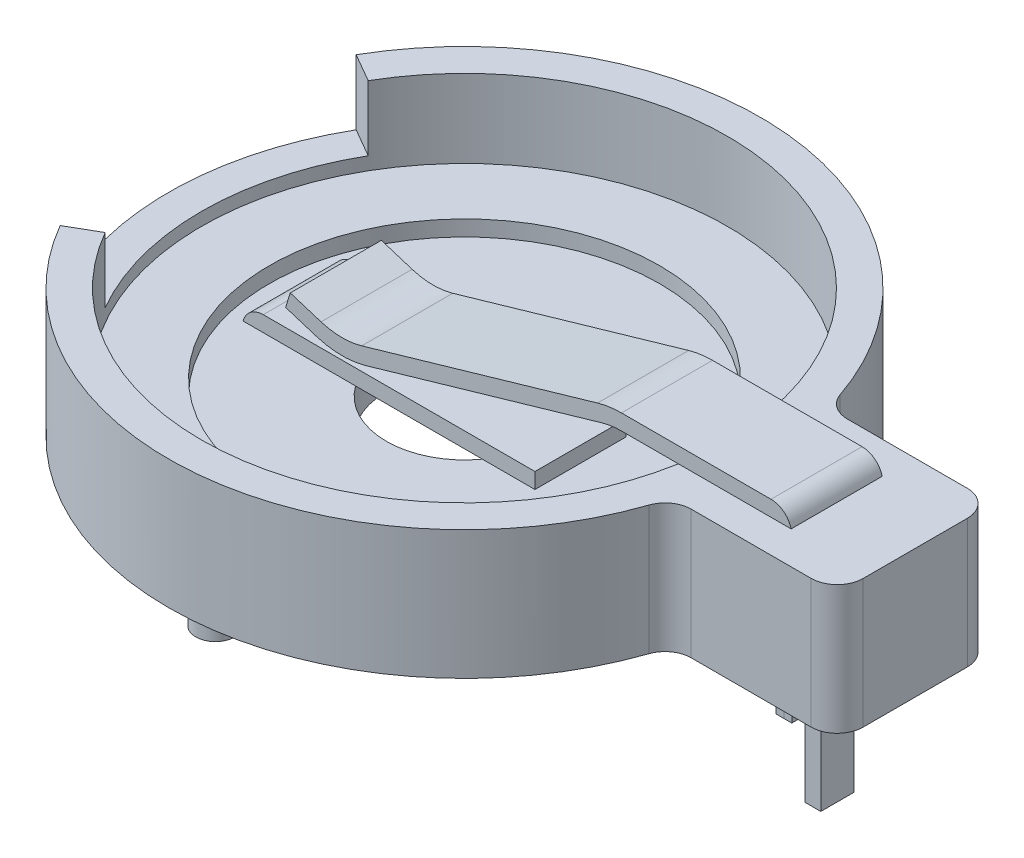
from build123d import *

# Parameters (mm, degrees)
EXTRUDE_1_DEPTH     = 4.95
SKETCH_2_R          = 10.11
CUT_EXTRUDE_1_DEPTH = 3
CUT_EXTRUDE_2_DEPTH = 2.5
SKETCH_4_R          = 7.5
CUT_EXTRUDE_3_DEPTH = 0.6
CUT_EXTRUDE_4_REACH = 23.036
SKETCH_5_R          = 3
SKETCH_8_W          = 3.5
SKETCH_8_H          = 0.6
SKETCH_9_R          = 0.75
EXTRUDE_2_DEPTH     = 1.5
SKETCH_10_W         = 0.6
SKETCH_10_H         = 1.115
CUT_EXTRUDE_5_DEPTH = 3.5
SKETCH_16_W         = 0.6
SKETCH_16_H         = 1.27
EXTRUDE_3_DEPTH     = 3.5


with BuildPart() as part:
    # Эскиз1 → Вытянуть1 (new body)
    with BuildSketch(Plane(origin=(0, 0, 0), x_dir=(1, 0, 0), z_dir=(0, 1, 0))):
        with BuildLine():
            Line((11.710705572, 3), (16.325, 3))
            ThreePointArc((16.325, 3), (17.032106781, 2.707106781), (17.325, 2))
            Line((17.325, 2), (17.325, -2))
            ThreePointArc((17.325, -2), (17.032106781, -2.707106781), (16.325, -3))
            Line((16.325, -3), (11.710705572, -3))
            ThreePointArc((11.710705572, -3), (11.128997881, -3.186602089), (10.76438593, -3.676767677))
            ThreePointArc((10.76438593, -3.676767677), (-11.375, 0), (10.76438593, 3.676767677))
            ThreePointArc((10.76438593, 3.676767677), (11.128997881, 3.186602089), (11.710705572, 3))
        make_face()
    extrude(amount=EXTRUDE_1_DEPTH)

    # Эскиз2 → Вырез-Вытянуть1 (cut)
    with BuildSketch(Plane(origin=(0, 4.95, 0), x_dir=(-1, 0, 0), z_dir=(0, 1, 0))):
        Circle(SKETCH_2_R)
    extrude(amount=-CUT_EXTRUDE_1_DEPTH, mode=Mode.SUBTRACT)

    # Эскиз3 → Вырез-Вытянуть2 (cut)
    with BuildSketch(Plane(origin=(0, 4.95, 0), x_dir=(-1, 0, 0), z_dir=(0, 1, 0))):
        with BuildLine():
            Line((8.755516832, -5.055), (9.851038968, -5.6875))
            ThreePointArc((9.851038968, -5.6875), (11.375, 0), (9.851038968, 5.6875))
            Line((9.851038968, 5.6875), (8.755516832, 5.055))
            ThreePointArc((8.755516832, 5.055), (10.11, 0), (8.755516832, -5.055))
        make_face()
    extrude(amount=-CUT_EXTRUDE_2_DEPTH, mode=Mode.SUBTRACT)

    # Эскиз4 → Вырез-Вытянуть3 (cut)
    with BuildSketch(Plane(origin=(0, 1.95, 0), x_dir=(-1, 0, 0), z_dir=(0, 1, 0))):
        Circle(SKETCH_4_R)
    extrude(amount=-CUT_EXTRUDE_3_DEPTH, mode=Mode.SUBTRACT)

    # Эскиз5 → Вырез-Вытянуть4 (cut, up to next)
    with BuildSketch(Plane(origin=(0, 1.35, 0), x_dir=(-1, 0, 0), z_dir=(0, 1, 0)), mode=Mode.PRIVATE) as cut_extrude_4_sk1:
        Circle(SKETCH_5_R)
    cut_extrude_4_tool1 = extrude(cut_extrude_4_sk1.sketch, amount=-CUT_EXTRUDE_4_REACH, mode=Mode.PRIVATE) & part.part
    add(cut_extrude_4_tool1.solids().sort_by_distance((0, 1.35, 0))[0], mode=Mode.SUBTRACT)

    # По траектории2: sweep along a path in Эскиз7
    with BuildLine(Plane.XY) as sweep_2_path:
        Line((-6.482147214, -5), (-6.482147214, 1.15))
        ThreePointArc((-6.482147214, 1.15), (-6.335700604, 1.503553391), (-5.982147214, 1.65))
        Line((-5.982147214, 1.65), (4.458438225, 1.65))
    # Эскиз8 → По траектории2 (sweep)
    with BuildSketch(Plane(origin=(4.458438225, 0, 0), x_dir=(0, 0, -1), z_dir=(1, 0, 0))):
        with Locations((0, 1.65)):
            Rectangle(SKETCH_8_W, SKETCH_8_H)
    sweep(path=sweep_2_path.line)

    # Эскиз9 → Вытянуть2 (add)
    with BuildSketch(Plane.XZ):
        with Locations((0, 9.575)):
            Circle(SKETCH_9_R)
        with Locations((8.292193241, -4.7875)):
            Circle(SKETCH_9_R)
        with Locations((-8.292193241, -4.7875)):
            Circle(SKETCH_9_R)
    extrude(amount=EXTRUDE_2_DEPTH)

    # Эскиз10 → Вырез-Вытянуть5 (cut)
    with BuildSketch(Plane.XZ.offset(5)):
        with Locations((-6.482147214, 1.1925)):
            Rectangle(SKETCH_10_W, SKETCH_10_H)
        with Locations((-6.482147214, -1.1925)):
            Rectangle(SKETCH_10_W, SKETCH_10_H)
    extrude(amount=-CUT_EXTRUDE_5_DEPTH, mode=Mode.SUBTRACT)

    # По траектории3: sweep along a path in Эскиз12
    with BuildLine(Plane.XY) as sweep_3_path:
        Line((14.017852786, 0), (14.017852786, 4.75))
        ThreePointArc((14.017852786, 4.75), (13.871406177, 5.103553391), (13.517852786, 5.25))
        Line((13.517852786, 5.25), (7.770329112, 5.25))
        ThreePointArc((7.770329112, 5.25), (7.348318318, 5.220169505), (6.934700052, 5.13127126))
        Line((6.934700052, 5.13127126), (-2.128848466, 2.502652205))
        ThreePointArc((-2.128848466, 2.502652205), (-2.998479817, 2.384116164), (-3.865200914, 2.522333456))
        Line((-3.865200914, 2.522333456), (-5.047739274, 2.89455308))
    # Эскиз14 → По траектории3 (sweep)
    with BuildSketch(Plane.XZ):
        Polygon((14.317852786, -1.76229338), (14.317852786, 1.73770662), (14.017852786, 1.73770662), (13.717852786, 1.73770662), (13.717852786, -1.76229338), (14.017852786, -1.76229338), align=None)
    sweep(path=sweep_3_path.line)

    # По траектории4: sweep along a path in Эскиз15
    with BuildLine(Plane.XY) as sweep_4_path:
        Line((14.017852786, 0), (14.017852786, -1.5))
    # Эскиз14<3> → По траектории4 (sweep)
    with BuildSketch(Plane.XZ):
        Polygon((14.317852786, -1.76229338), (14.317852786, 1.73770662), (14.017852786, 1.73770662), (13.717852786, 1.73770662), (13.717852786, -1.76229338), (14.017852786, -1.76229338), align=None)
    sweep(path=sweep_4_path.line)

    # Эскиз16 → Вытянуть3 (add)
    with BuildSketch(Plane.XZ.offset(1.5)):
        with Locations((14.017852786, -0.01229338)):
            Rectangle(SKETCH_16_W, SKETCH_16_H)
    extrude(amount=EXTRUDE_3_DEPTH)


solid = part.part
